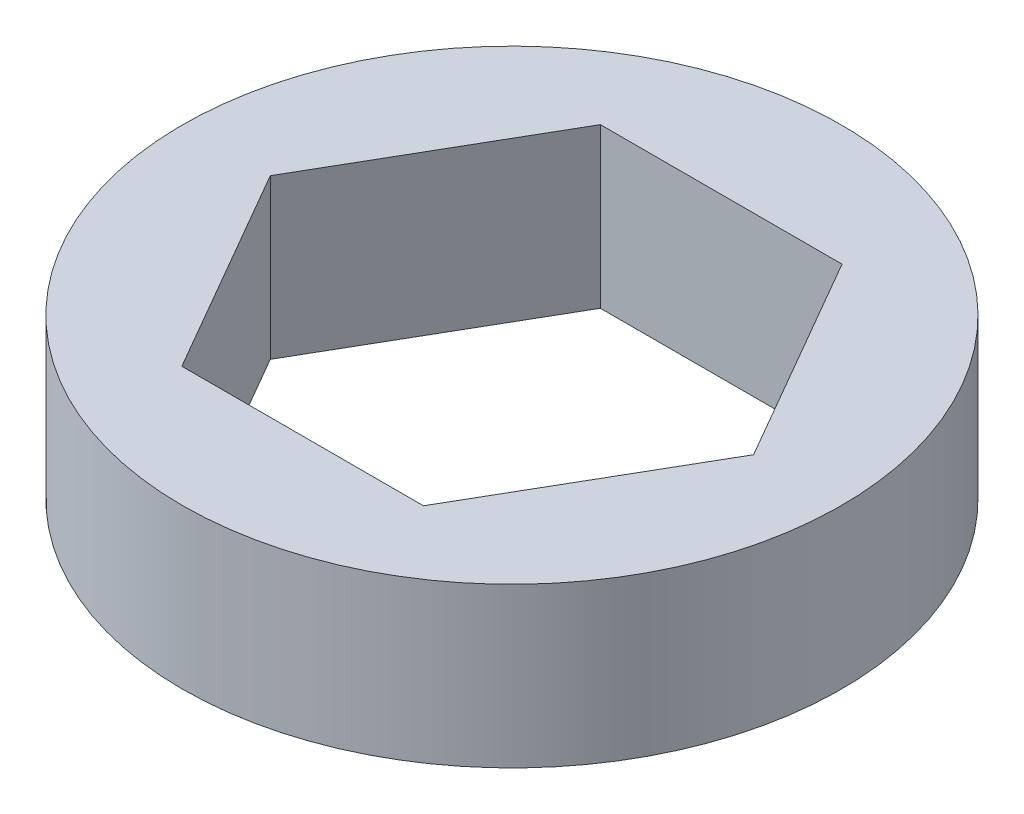
from build123d import *

# Parameters (mm, degrees)
SKETCH1_R           = 10
BOSS_EXTRUDE1_DEPTH = 4.826


with BuildPart() as part:
    # Sketch1 → Boss-Extrude1 (new body)
    with BuildSketch(Plane(origin=(0, 0, 0), x_dir=(1, 0, 0), z_dir=(0, 1, 0))):
        with Locations(Location((0, 0, 0), (0, 0, 270))):
            Circle(SKETCH1_R)
        Polygon((-7.332348419, 0), (-3.666174209, -6.35), (3.666174209, -6.35), (7.332348419, 0), (3.666174209, 6.35), (-3.666174209, 6.35), align=None, mode=Mode.SUBTRACT)
    extrude(amount=BOSS_EXTRUDE1_DEPTH)


solid = part.part
